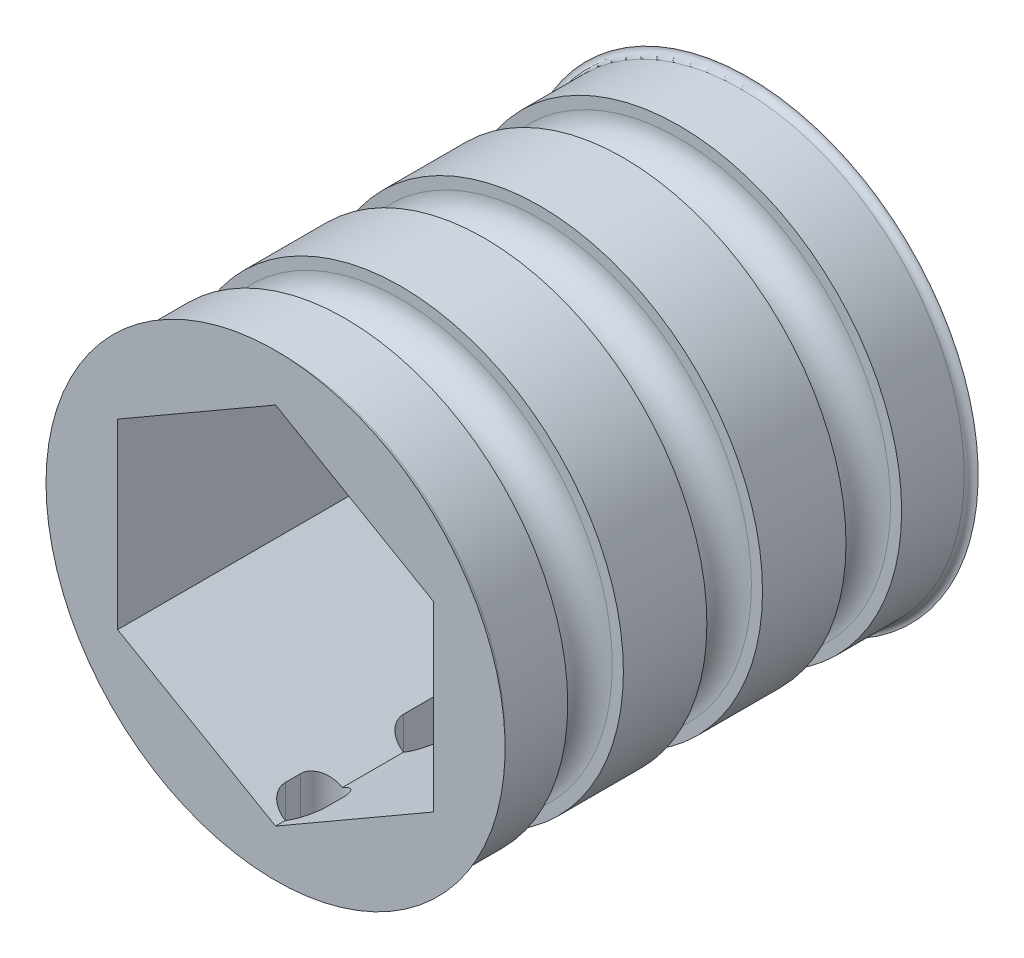
from build123d import *

# Parameters (mm, degrees)
ESQUISSE1_R              = 17
ESQUISSE1_R_2            = 3.25
BOSS_EXTRU_1_DEPTH       = 34
ENL_V_MAT_EXTRU_9_DEPTH  = 18
ESQUISSE11_R             = 2.1
ENL_V_MAT_EXTRU_10_DEPTH = 42.641325627
ESQUISSE12_R             = 4.25
ENL_V_MAT_EXTRU_11_DEPTH = 4
ESQUISSE14_R             = 13.105851111
ENL_V_MAT_EXTRU_12_DEPTH = 12
ENL_V_MAT_EXTRU_13_DEPTH = 42.237119201


with BuildPart() as part:
    # Esquisse1 → Boss.-Extru.1 (new body)
    with BuildSketch(Plane.XY):
        Circle(ESQUISSE1_R)
        Circle(ESQUISSE1_R_2, mode=Mode.SUBTRACT)
    extrude(amount=BOSS_EXTRU_1_DEPTH)

    # Esquisse9 → Enlèv. mat.-Extru.9 (cut)
    with BuildSketch(Plane.XY.offset(34)):
        Polygon((11.35, -6.552925555), (11.35, 6.552925555), (0, 13.105851111), (-11.35, 6.552925555), (-11.35, -6.552925555), (0, -13.105851111), align=None)
    extrude(amount=-ENL_V_MAT_EXTRU_9_DEPTH, mode=Mode.SUBTRACT)

    # Esquisse11 → Enlèv. mat.-Extru.10 (cut, through all)
    with BuildSketch(Plane(origin=(0, 0, 0), x_dir=(-1, 0, 0), z_dir=(0, 0, -1))):
        with Locations((-6.92820323, 4)):
            Circle(ESQUISSE11_R)
        with Locations((6.92820323, 4)):
            Circle(ESQUISSE11_R)
        with Locations((0, -8)):
            Circle(ESQUISSE11_R)
    extrude(amount=-ENL_V_MAT_EXTRU_10_DEPTH, mode=Mode.SUBTRACT)

    # Esquisse12 → Enlèv. mat.-Extru.11 (cut)
    with BuildSketch(Plane(origin=(0, 0, 0), x_dir=(-1, 0, 0), z_dir=(0, 0, -1))):
        with Locations((-6.92820323, 4)):
            Circle(ESQUISSE12_R)
        with Locations((6.92820323, 4)):
            Circle(ESQUISSE12_R)
        with Locations((0, -8)):
            Circle(ESQUISSE12_R)
    extrude(amount=-ENL_V_MAT_EXTRU_11_DEPTH, mode=Mode.SUBTRACT)

    # Esquisse13 → Enlèvement de matière-Révolution1 (revolve, cut)
    with BuildSketch(Plane(origin=(0, 0, 0), x_dir=(1, 0, 0), z_dir=(0, 1, 0))):
        with BuildLine():
            Line((-17, -34), (-16.5, -34))
            ThreePointArc((-16.5, -34), (-16.146446609, -33.853553391), (-16, -33.5))
            Line((-16, -33.5), (-16, -29))
            Line((-16, -29), (-15.2, -29))
            ThreePointArc((-15.2, -29), (-13.2, -27), (-15.2, -25))
            Line((-15.2, -25), (-16, -25))
            Line((-16, -25), (-16, -19))
            Line((-16, -19), (-15.2, -19))
            ThreePointArc((-15.2, -19), (-13.2, -17), (-15.2, -15))
            Line((-15.2, -15), (-16, -15))
            Line((-16, -15), (-16, -9))
            Line((-16, -9), (-15.2, -9))
            ThreePointArc((-15.2, -9), (-13.2, -7), (-15.2, -5))
            Line((-15.2, -5), (-16, -5))
            Line((-16, -5), (-16, -0.5))
            ThreePointArc((-16, -0.5), (-16.146446609, -0.146446609), (-16.5, 0))
            Line((-16.5, 0), (-17, 0))
            Line((-17, 0), (-17, -34))
        make_face()
    revolve(axis=Axis((0, 0, 0), (0, 0, 1)), mode=Mode.SUBTRACT)

    # Esquisse14 → Enlèv. mat.-Extru.12 (cut)
    with BuildSketch(Plane(origin=(0, 0, 0), x_dir=(-1, 0, 0), z_dir=(0, 0, -1))):
        Circle(ESQUISSE14_R)
    extrude(amount=-ENL_V_MAT_EXTRU_12_DEPTH, mode=Mode.SUBTRACT)

    # Esquisse15 → Enlèv. mat.-Extru.13 (cut, through all)
    with BuildSketch(Plane(origin=(0, 0, 0), x_dir=(1, 0, 0), z_dir=(0, 1, 0))):
        with BuildLine():
            Line((1.5, -20.7), (1.5, -23.3))
            ThreePointArc((1.5, -23.3), (0, -24.8), (-1.5, -23.3))
            Line((-1.5, -23.3), (-1.5, -20.7))
            ThreePointArc((-1.5, -20.7), (0, -19.2), (1.5, -20.7))
        make_face()
        with BuildLine():
            Line((1.5, -30.7), (1.5, -31.8))
            ThreePointArc((1.5, -31.8), (0, -33.3), (-1.5, -31.8))
            Line((-1.5, -31.8), (-1.5, -30.7))
            ThreePointArc((-1.5, -30.7), (0, -29.2), (1.5, -30.7))
        make_face()
    extrude(amount=-ENL_V_MAT_EXTRU_13_DEPTH, mode=Mode.SUBTRACT)


solid = part.part
